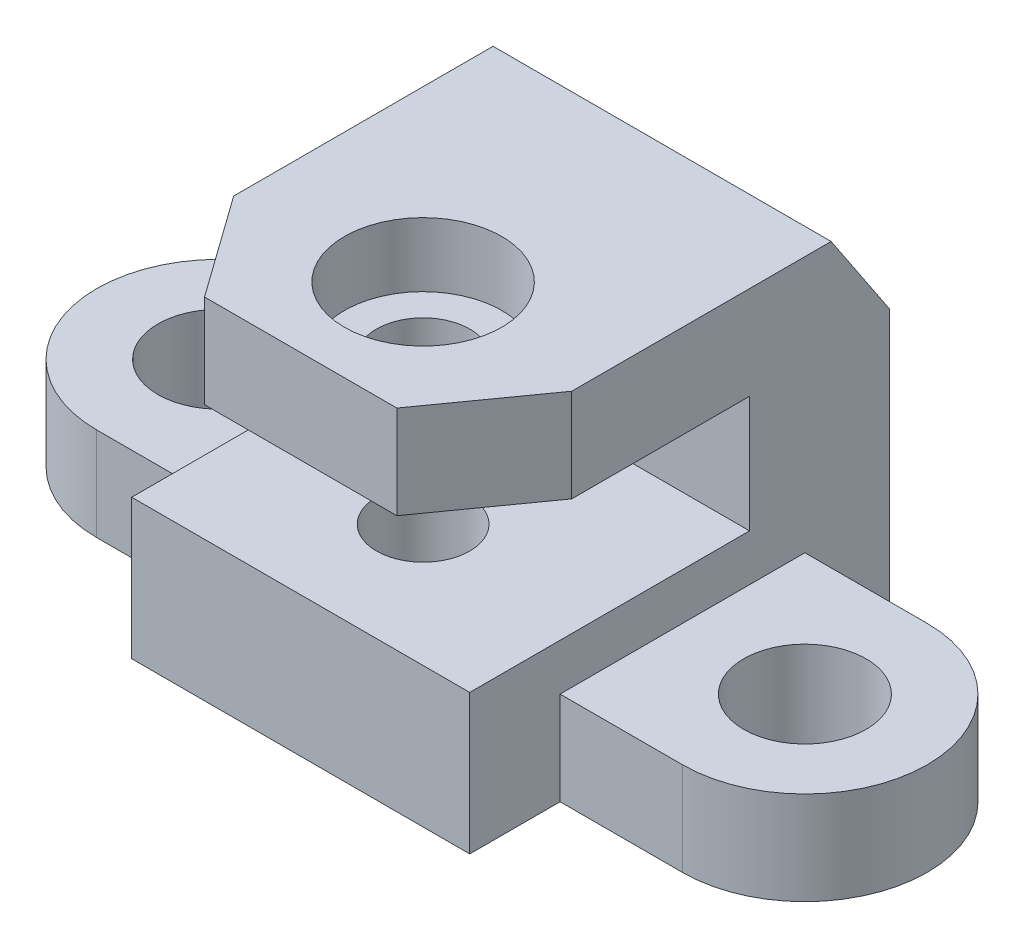
from build123d import *

# Parameters (mm, degrees)
SKETCH_1_W               = 116
SKETCH_1_H               = 144
EXTRUDE_1_DEPTH          = 120
SKETCH_2_R               = 21
EXTRUDE_3_DEPTH          = 32
SKETCH_4_R               = 16
CUT_EXTRUDE_1_DEPTH      = 120
SKETCH_5_R               = 27
CUT_EXTRUDE_2_DEPTH      = 22
CUT_EXTRUDE_6_DEPTH      = 58
CUT_EXTRUDE_6_DEPTH_BACK = 58
SKETCH_13_W              = 96
SKETCH_13_H              = 40
CUT_EXTRUDE_7_DEPTH      = 32


with BuildPart() as part:
    # 草图1 → 凸台-拉伸1 (new body)
    with BuildSketch(Plane(origin=(0, 0, 0), x_dir=(1, 0, 0), z_dir=(0, 1, 0))):
        with Locations((0, 72)):
            Rectangle(SKETCH_1_W, SKETCH_1_H)
    extrude(amount=EXTRUDE_1_DEPTH)

    # 草图2 → 凸台-拉伸3 (add)
    # profile 1 of 2: a face of its own
    with BuildSketch(Plane(origin=(0, 0, 0), x_dir=(1, 0, 0), z_dir=(0, 1, 0))):
        with BuildLine():
            Line((-100, 114), (-58, 114))
            Line((-58, 114), (-58, 30))
            Line((-58, 30), (-100, 30))
            ThreePointArc((-100, 30), (-142, 72), (-100, 114))
        make_face()
        with Locations((-100, 72)):
            Circle(SKETCH_2_R, mode=Mode.SUBTRACT)
    # profile 2 of 2: a face of its own
    with BuildSketch(Plane(origin=(0, 0, 0), x_dir=(1, 0, 0), z_dir=(0, 1, 0))):
        with BuildLine():
            Line((100, 115), (58, 115))
            Line((58, 115), (58, 31))
            Line((58, 31), (100, 31))
            ThreePointArc((100, 31), (142, 73), (100, 115))
        make_face()
        with Locations((100, 73)):
            Circle(SKETCH_2_R, mode=Mode.SUBTRACT)
    extrude(amount=EXTRUDE_3_DEPTH)

    # 草图4 → 切除-拉伸1 (cut)
    with BuildSketch(Plane(origin=(0, 120, 0), x_dir=(1, 0, 0), z_dir=(0, 1, 0))):
        with Locations((0, 42)):
            Circle(SKETCH_4_R)
    extrude(amount=-CUT_EXTRUDE_1_DEPTH, mode=Mode.SUBTRACT)

    # 草图5 → 切除-拉伸2 (cut)
    with BuildSketch(Plane(origin=(0, 120, 0), x_dir=(1, 0, 0), z_dir=(0, 1, 0))):
        with Locations((0, 42)):
            Circle(SKETCH_5_R)
    extrude(amount=-CUT_EXTRUDE_2_DEPTH, mode=Mode.SUBTRACT)

    # 草图13 → 切除-拉伸6 (cut, two sides: drawn at the far end of the back side and taken through both)
    with BuildSketch(Plane(origin=(0, 0, 0), x_dir=(0, 0, -1), z_dir=(1, 0, 0)).offset(-CUT_EXTRUDE_6_DEPTH_BACK)):
        Polygon((144, 120), (124, 120), (144, 90), align=None)
        with Locations((48, 68)):
            Rectangle(SKETCH_13_W, SKETCH_13_H)
    extrude(amount=CUT_EXTRUDE_6_DEPTH + CUT_EXTRUDE_6_DEPTH_BACK, mode=Mode.SUBTRACT)

    # 草图15 → 切除-拉伸7 (cut)
    with BuildSketch(Plane(origin=(0, 120, 0), x_dir=(1, 0, 0), z_dir=(0, 1, 0))):
        Polygon((-58, 0), (-58, 35), (-33, 0), align=None)
        Polygon((58, 0), (58, 35), (33, 0), align=None)
    extrude(amount=-CUT_EXTRUDE_7_DEPTH, mode=Mode.SUBTRACT)


solid = part.part
